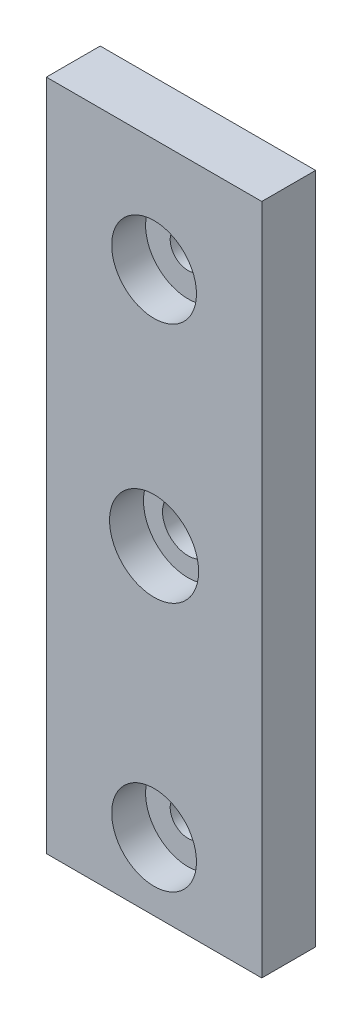
from build123d import *

# Parameters (mm, degrees)
SKETCH1_W           = 25.4
SKETCH1_H           = 6.35
BOSS_EXTRUDE1_DEPTH = 100
SKETCH2_R           = 2.1
CUT_EXTRUDE1_DEPTH  = 110.906322202
SKETCH2_3_R         = 5
CUT_EXTRUDE2_DEPTH  = 4
SKETCH2_4_R         = 5
CUT_EXTRUDE3_DEPTH  = 4
SKETCH5_W           = 25.4
SKETCH5_H           = 5
SKETCH5_H_2         = 12
CUT_EXTRUDE4_DEPTH  = 110.906322202
SKETCH6_R           = 5.25
CUT_EXTRUDE5_DEPTH  = 106.377415322
SKETCH7_W           = 25.4
SKETCH7_H           = 3.7
CUT_EXTRUDE6_DEPTH  = 106.377415322
BOSS_EXTRUDE2_START = -2.35
SKETCH8_R           = 5.25
SKETCH8_R_2         = 3
BOSS_EXTRUDE2_DEPTH = 2.35


with BuildPart() as part:
    # Sketch1 → Boss-Extrude1 (new body)
    with BuildSketch(Plane(origin=(0, 0, 0), x_dir=(1, 0, 0), z_dir=(0, 1, 0))):
        with Locations((32.456141995, 0.058688594)):
            Rectangle(SKETCH1_W, SKETCH1_H)
    extrude(amount=BOSS_EXTRUDE1_DEPTH)

    # Sketch2 → Cut-Extrude1 (cut, through all)
    with BuildSketch(Plane.XY.offset(3.116311406)):
        with Locations((32.456141995, 81.7)):
            Circle(SKETCH2_R)
        with Locations((32.456141995, 23.71)):
            Circle(SKETCH2_R)
    extrude(amount=-CUT_EXTRUDE1_DEPTH, mode=Mode.SUBTRACT)

    # Sketch2<3> → Cut-Extrude2 (cut)
    with BuildSketch(Plane.XY.offset(3.116311406)):
        with Locations((32.456141995, 81.7)):
            Circle(SKETCH2_3_R)
    extrude(amount=-CUT_EXTRUDE2_DEPTH, mode=Mode.SUBTRACT)

    # Sketch2<4> → Cut-Extrude3 (cut)
    with BuildSketch(Plane.XY.offset(3.116311406)):
        with Locations((32.456141995, 23.71)):
            Circle(SKETCH2_4_R)
    extrude(amount=-CUT_EXTRUDE3_DEPTH, mode=Mode.SUBTRACT)

    # Sketch5 → Cut-Extrude4 (cut, through all)
    with BuildSketch(Plane.XY.offset(3.116311406)):
        with Locations((32.456141995, 97.5)):
            Rectangle(SKETCH5_W, SKETCH5_H)
        with Locations((32.456141995, 6)):
            Rectangle(SKETCH5_W, SKETCH5_H_2)
    extrude(amount=-CUT_EXTRUDE4_DEPTH, mode=Mode.SUBTRACT)

    # Sketch6 → Cut-Extrude5 (cut, through all)
    with BuildSketch(Plane.XY.offset(3.116311406)):
        with Locations((32.456141995, 53.471)):
            Circle(SKETCH6_R)
    extrude(amount=-CUT_EXTRUDE5_DEPTH, mode=Mode.SUBTRACT)

    # Sketch7 → Cut-Extrude6 (cut, through all)
    with BuildSketch(Plane.XY.offset(3.116311406)):
        with Locations((32.456141995, 13.85)):
            Rectangle(SKETCH7_W, SKETCH7_H)
    extrude(amount=-CUT_EXTRUDE6_DEPTH, mode=Mode.SUBTRACT)

    # Sketch8 → Boss-Extrude2 (add)
    with BuildSketch(Plane(origin=(0, 0, -3.233688594), x_dir=(-1, 0, 0), z_dir=(0, 0, -1)).offset(BOSS_EXTRUDE2_START)):
        with Locations((-32.456141995, 53.471)):
            Circle(SKETCH8_R)
        with Locations((-32.456141995, 53.471)):
            Circle(SKETCH8_R_2, mode=Mode.SUBTRACT)
    extrude(amount=BOSS_EXTRUDE2_DEPTH)


solid = part.part
